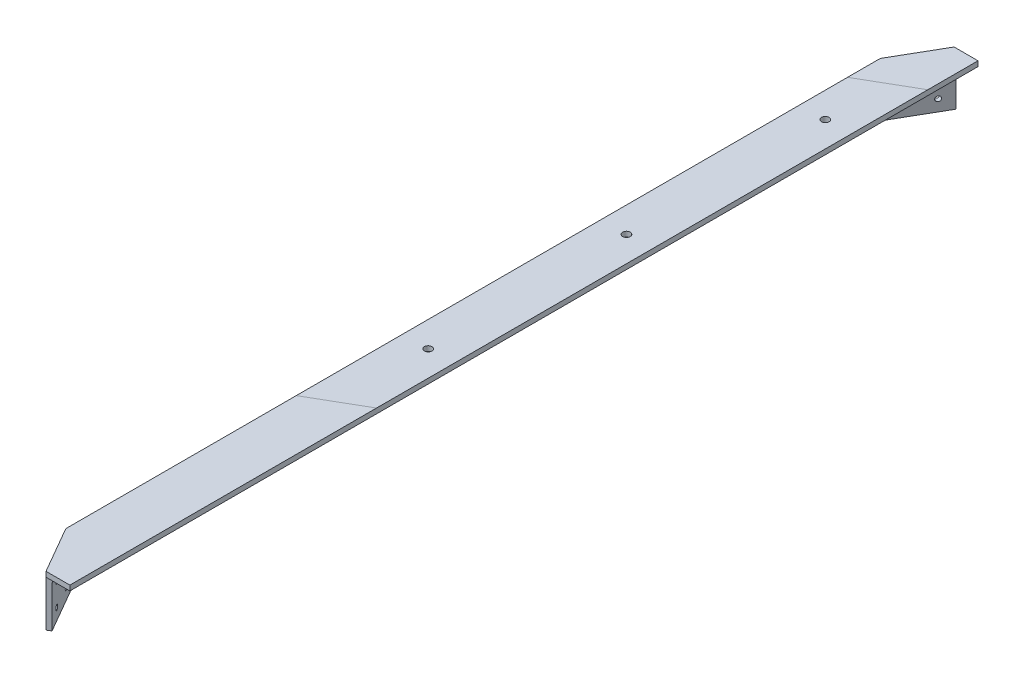
from build123d import *

# Parameters (mm, degrees)
BOSS_EXTRUDE1_DEPTH  = 640
BOSS_EXTRUDE2_DEPTH  = 8
BOSS_EXTRUDE3_DEPTH  = 72
SKETCH6_R            = 4
CUT_EXTRUDE1_DEPTH   = 8
FILLET1_R            = 10
FILLET2_R            = 8
FILLET1_OF_MIRROR1_R = 10
FILLET2_OF_MIRROR1_R = 8
SKETCH10_R           = 6
CUT_EXTRUDE2_DEPTH   = 8


with BuildPart() as part:
    # Sketch1 → Boss-Extrude1 (new body)
    with BuildSketch(Plane.XY):
        Polygon((-8, 8), (72, 8), (72, 0), (0, 0), (0, -72), (-8, -72), align=None)
    boss_extrude1 = extrude(amount=BOSS_EXTRUDE1_DEPTH)

    # Sketch3 → Boss-Extrude2 (add)
    with BuildSketch(Plane(origin=(0, 0, 0), x_dir=(1, 0, 0), z_dir=(0, 1, 0))):
        Polygon((-8, -640), (34.5, -713.612159322), (72, -713.612159322), (72, -640), align=None)
    boss_extrude2 = extrude(amount=BOSS_EXTRUDE2_DEPTH)

    # Sketch4 → Boss-Extrude3 (add)
    with BuildSketch(Plane.XZ):
        Polygon((-8, 640), (34.5, 713.612159322), (40.5, 710.148057707), (0, 640), align=None)
    boss_extrude3 = extrude(amount=BOSS_EXTRUDE3_DEPTH)

    # Sketch6 → Cut-Extrude1 (cut)
    with BuildSketch(Plane(origin=(-277.128129211, 0, 160), x_dir=(-0.4999999999999956, 0, -0.8660254037844413), z_dir=(0.8660254037844413, 0, -0.4999999999999956))):
        with Locations((-615.006258422, -18)):
            Circle(SKETCH6_R)
        with Locations((-574.506258422, -18)):
            Circle(SKETCH6_R)
        with Locations((-574.506258422, -54)):
            Circle(SKETCH6_R)
        with Locations((-615.006258422, -54)):
            Circle(SKETCH6_R)
    cut_extrude1 = extrude(amount=-CUT_EXTRUDE1_DEPTH, mode=Mode.SUBTRACT)

    # Fillet1
    fillet1_edges = [part.edges().sort_by_distance(p)[0] for p in [
        (0, -36, 640),
        (-8, -32, 640),
    ]]
    fillet(fillet1_edges, radius=FILLET1_R)

    # Fillet2
    fillet2_edges = [part.edges().sort_by_distance(p)[0] for p in [
        (20.919872981, 0, 676.234282891),
        (0, 0, 318.660254038),
        (0.340741737, 0, 639.908698527),
    ]]
    fillet(fillet2_edges, radius=FILLET2_R)

    # Mirror1: Boss-Extrude1, Boss-Extrude2, Boss-Extrude3, Cut-Extrude1 across plane
    add(boss_extrude1.mirror(Plane.XY))
    add(boss_extrude2.mirror(Plane.XY))
    add(boss_extrude3.mirror(Plane.XY))
    add(cut_extrude1.mirror(Plane.XY), mode=Mode.SUBTRACT)

    # Fillet1 of Mirror1
    fillet1_of_mirror1_edges = [part.edges().sort_by_distance(p)[0] for p in [
        (0, -36, -640),
        (-8, -32, -640),
    ]]
    fillet(fillet1_of_mirror1_edges, radius=FILLET1_OF_MIRROR1_R)

    # Fillet2 of Mirror1
    fillet2_of_mirror1_edges = [part.edges().sort_by_distance(p)[0] for p in [
        (20.919872981, 0, -676.234282891),
        (0, 0, -318.660254038),
        (0.340741737, 0, -639.908698527),
    ]]
    fillet(fillet2_of_mirror1_edges, radius=FILLET2_OF_MIRROR1_R)

    # Sketch10 → Cut-Extrude2 (cut)
    with BuildSketch(Plane(origin=(0, 8, 0), x_dir=(1, 0, 0), z_dir=(0, 1, 0))):
        with Locations(Location((32, 513.612159322, 0), (0, 0, 180))):
            Circle(SKETCH10_R)
        with Locations(Location((32, 201.112159322, 0), (0, 0, 180))):
            Circle(SKETCH10_R)
        with Locations(Location((32, -110.512159322, 0), (0, 0, 180))):
            Circle(SKETCH10_R)
    extrude(amount=-CUT_EXTRUDE2_DEPTH, mode=Mode.SUBTRACT)


solid = part.part
